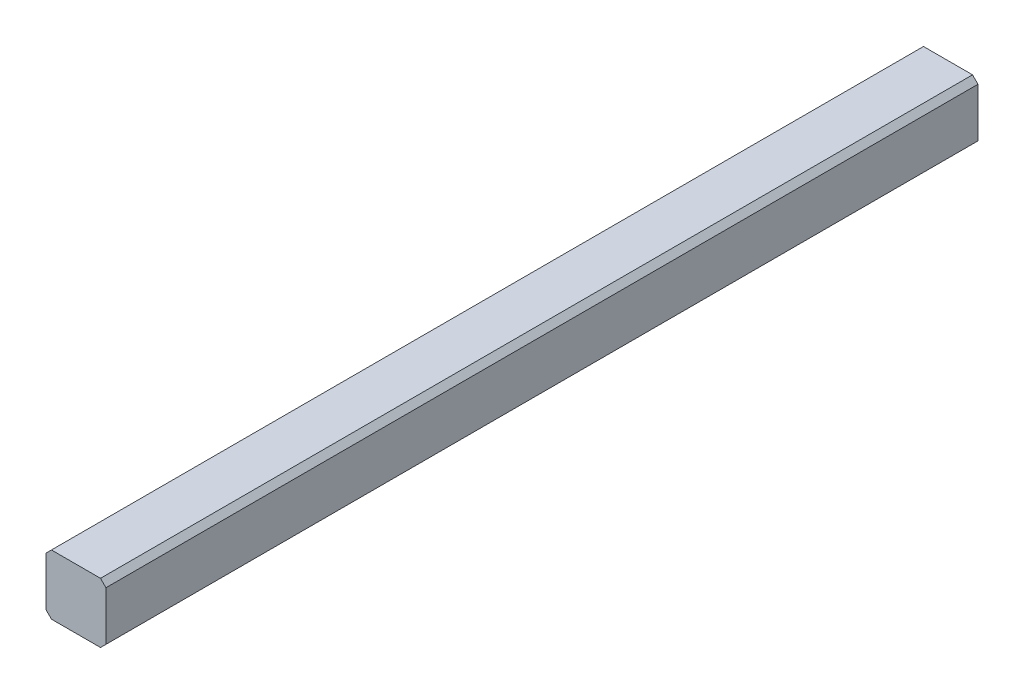
from build123d import *

# Parameters (mm, degrees)
ESQUISSE1_W             = 55
ESQUISSE1_H             = 55
BOSS_EXTRU_1_DEPTH      = 800
ENL_V_MAT_EXTRU_1_DEPTH = 30
ENL_V_START             = -55
ENL_V_MAT_EXTRU_3_DEPTH = 30
CHANFREIN1_SIZE         = 5


with BuildPart() as part:
    # Esquisse1 → Boss.-Extru.1 (new body)
    with BuildSketch(Plane.XY):
        with Locations((27.5, 27.5)):
            Rectangle(ESQUISSE1_W, ESQUISSE1_H)
    extrude(amount=BOSS_EXTRU_1_DEPTH)

    # Esquisse2 → Enlèv. mat.-Extru.1 (cut)
    with BuildSketch(Plane.XZ):
        with BuildLine():
            Line((35.5, 175), (35.5, 145))
            ThreePointArc((35.5, 145), (27.5, 137), (19.5, 145))
            Line((19.5, 145), (19.5, 175))
            ThreePointArc((19.5, 175), (27.5, 183), (35.5, 175))
        make_face()
        with BuildLine():
            Line((19.5, 735), (19.5, 765))
            ThreePointArc((19.5, 765), (27.5, 773), (35.5, 765))
            Line((35.5, 765), (35.5, 735))
            ThreePointArc((35.5, 735), (27.5, 727), (19.5, 735))
        make_face()
    extrude(amount=-ENL_V_MAT_EXTRU_1_DEPTH, mode=Mode.SUBTRACT)

    # Esquisse3<2> → Enlèv. mat.-Extru.3 (cut)
    with BuildSketch(Plane(origin=(55, 0, 0), x_dir=(0, 0, -1), z_dir=(1, 0, 0)).offset(ENL_V_START)):
        with BuildLine():
            Line((-175, 35.5), (-145, 35.5))
            ThreePointArc((-145, 35.5), (-137, 27.5), (-145, 19.5))
            Line((-145, 19.5), (-175, 19.5))
            ThreePointArc((-175, 19.5), (-183, 27.5), (-175, 35.5))
        make_face()
        with BuildLine():
            Line((-765, 35.5), (-735, 35.5))
            ThreePointArc((-735, 35.5), (-727, 27.5), (-735, 19.5))
            Line((-735, 19.5), (-765, 19.5))
            ThreePointArc((-765, 19.5), (-773, 27.5), (-765, 35.5))
        make_face()
    extrude(amount=ENL_V_MAT_EXTRU_3_DEPTH, mode=Mode.SUBTRACT)

    # Chanfrein1
    chanfrein1_edges = [part.edges().sort_by_distance(p)[0] for p in [
        (0, 55, 400),
        (55, 55, 400),
        (55, 0, 400),
        (0, 0, 400),
    ]]
    chamfer(chanfrein1_edges, length=CHANFREIN1_SIZE)


solid = part.part
